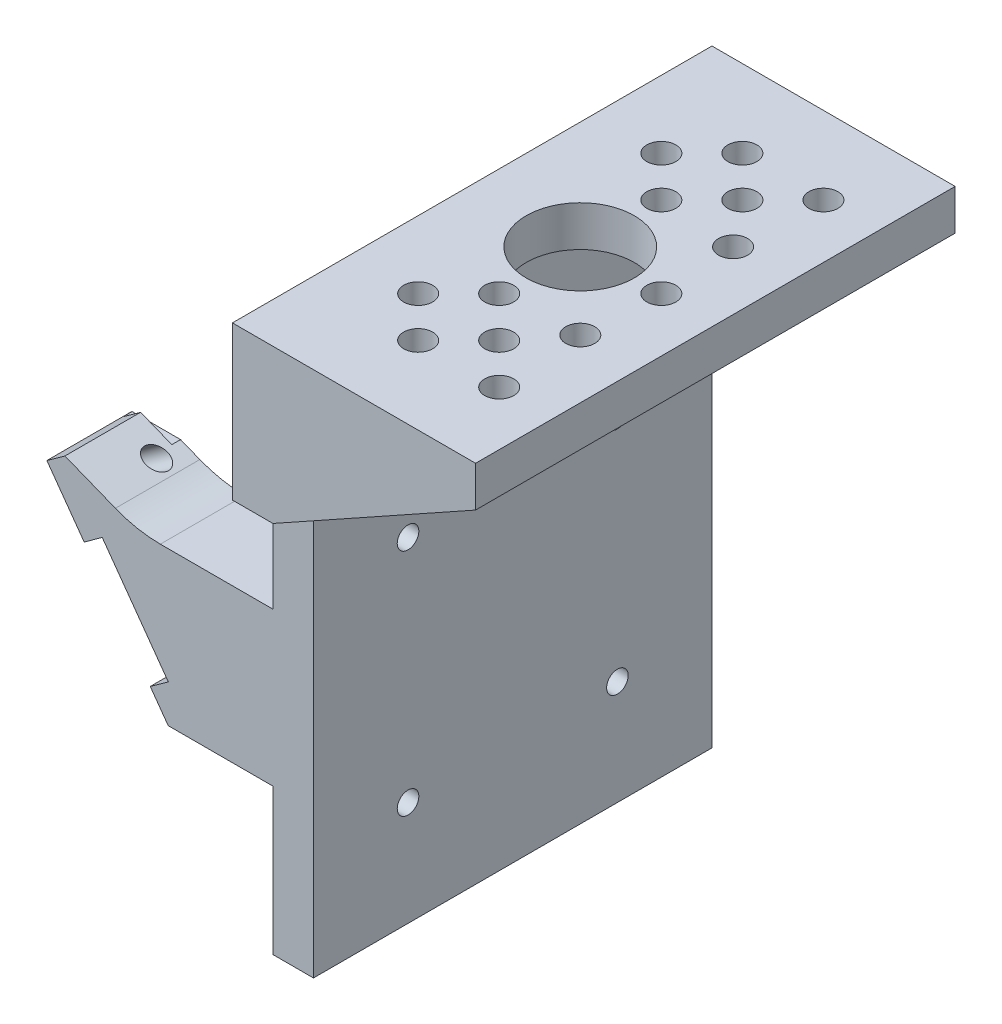
from build123d import *

# Parameters (mm, degrees)
EXTRUDE_1_DEPTH         = 35.5
SKETCH_2_W              = 29.5
SKETCH_2_H              = 39
CUT_EXTRUDE_2_DEPTH     = 15
SKETCH_3_W              = 3
SKETCH_3_H              = 30.64
CUT_EXTRUDE_3_DEPTH     = 3
SKETCH_4_R              = 0.8
CUT_EXTRUDE_4_DEPTH     = 3
SKETCH_5_R              = 1.075
SKETCH_5_R_2            = 4
CUT_EXTRUDE_6_DEPTH     = 4
SKETCH2_W               = 29.5
SKETCH2_H               = 42
BOSS_EXTRUDE1_DEPTH     = 22
CUT_EXTRUDE1_DEPTH      = 58.482606065
SKETCH4_W               = 17
SKETCH4_H               = 42
CUT_EXTRUDE2_DEPTH      = 22
SKETCH5_R               = 0.8
CUT_EXTRUDE3_DEPTH      = 6
CUT_EXTRUDE4_DEPTH      = 58.482606065
CUT_EXTRUDE4_DEPTH_BACK = 58.482606065
CUT_EXTRUDE5_DEPTH      = 57.282415378
CUT_EXTRUDE5_DEPTH_BACK = 57.282415378
CUT_EXTRUDE6_DEPTH      = 57.282415378
CUT_EXTRUDE6_DEPTH_BACK = 57.282415378
CUT_EXTRUDE7_DEPTH      = 57.073612332
CUT_EXTRUDE7_DEPTH_BACK = 57.073612332
SKETCH9_W               = 7.089051245
SKETCH9_H               = 1.624595939
CUT_EXTRUDE8_DEPTH      = 53.697841512
CUT_EXTRUDE8_DEPTH_BACK = 53.697841512
SKETCH11_W              = 2.8
SKETCH11_H              = 2.8
CUT_EXTRUDE9_DEPTH      = 58.864064842
CUT_EXTRUDE10_DEPTH     = 57.073612332
SKETCH13_W              = 6.25
SKETCH13_H              = 1.804834364
CUT_EXTRUDE11_DEPTH     = 1.647183607
FILLET1_R               = 10
FILLET2_R               = 9


with BuildPart() as part:
    # 草图1 → 凸台-拉伸1 (new body)
    with BuildSketch(Plane.XY):
        Polygon((0, 0), (18, 0), (18, -3), (3, -11.36), (3, -42), (0, -42), align=None)
    extrude(amount=EXTRUDE_1_DEPTH)

    # 草图2 → 切除-拉伸2 (cut)
    with BuildSketch(Plane(origin=(18, 0, 0), x_dir=(0, 0, -1), z_dir=(1, 0, 0))):
        with Locations((-17.75, -22.5)):
            Rectangle(SKETCH_2_W, SKETCH_2_H)
    extrude(amount=-CUT_EXTRUDE_2_DEPTH, mode=Mode.SUBTRACT)

    # 草图3 → 切除-拉伸3 (cut)
    with BuildSketch(Plane(origin=(0, 0, 0), x_dir=(0, 0, -1), z_dir=(1, 0, 0))):
        with Locations((-34, -26.68)):
            Rectangle(SKETCH_3_W, SKETCH_3_H)
        with Locations((-1.5, -26.68)):
            Rectangle(SKETCH_3_W, SKETCH_3_H)
    extrude(amount=CUT_EXTRUDE_3_DEPTH, mode=Mode.SUBTRACT)

    # 草图4 → 切除-拉伸4 (cut)
    with BuildSketch(Plane(origin=(0, 0, 0), x_dir=(0, 0, -1), z_dir=(1, 0, 0))):
        with Locations((-10, -17.25)):
            Circle(SKETCH_4_R)
        with Locations((-10, -34.25)):
            Circle(SKETCH_4_R)
        with Locations(Location((-25.5, -34.25, 0), (0, 0, 180))):
            Circle(SKETCH_4_R)
        with Locations(Location((-25.5, -17.25, 0), (0, 0, 180))):
            Circle(SKETCH_4_R)
    extrude(amount=CUT_EXTRUDE_4_DEPTH, mode=Mode.SUBTRACT)

    # 草图5 → 切除-拉伸6 (cut)
    with BuildSketch(Plane(origin=(0, 0, 0), x_dir=(1, 0, 0), z_dir=(0, 1, 0))):
        with Locations(Location((14, -17.75, 0), (0, 0, 270))):
            Circle(SKETCH_5_R)
        with Locations(Location((13.656854249, -23.406854249, 0), (0, 0, 270))):
            Circle(SKETCH_5_R)
        with Locations(Location((14, -29.75, 0), (0, 0, 270))):
            Circle(SKETCH_5_R)
        with Locations(Location((5, -26.75, 0), (0, 0, 270))):
            Circle(SKETCH_5_R)
        with Locations(Location((5, -8.75, 0), (0, 0, 270))):
            Circle(SKETCH_5_R)
        with Locations(Location((14, -5.75, 0), (0, 0, 270))):
            Circle(SKETCH_5_R)
        with Locations(Location((13.656854249, -12.093145751, 0), (0, 0, 270))):
            Circle(SKETCH_5_R)
        with Locations(Location((8, -17.75, 0), (0, 0, 270))):
            Circle(SKETCH_5_R_2)
        with Locations(Location((8, -23.75, 0), (0, 0, 270))):
            Circle(SKETCH_5_R)
        with Locations(Location((8, -11.75, 0), (0, 0, 270))):
            Circle(SKETCH_5_R)
        with Locations(Location((11, -26.75, 0), (0, 0, 270))):
            Circle(SKETCH_5_R)
        with Locations(Location((11, -8.75, 0), (0, 0, 270))):
            Circle(SKETCH_5_R)
        with Locations(Location((8, -29.75, 0), (0, 0, 270))):
            Circle(SKETCH_5_R)
        with Locations(Location((8, -5.75, 0), (0, 0, 270))):
            Circle(SKETCH_5_R)
    extrude(amount=-CUT_EXTRUDE_6_DEPTH, mode=Mode.SUBTRACT)

    # Sketch2 → Boss-Extrude1 (add)
    with BuildSketch(Plane.ZY):
        with Locations((17.75, -21)):
            Rectangle(SKETCH2_W, SKETCH2_H)
    extrude(amount=BOSS_EXTRUDE1_DEPTH)

    # Sketch3 → Cut-Extrude1 (cut, through all)
    with BuildSketch(Plane.XY.offset(32.5)):
        Polygon((0, -42), (-22, -11.36), (-22, -42), align=None)
    extrude(amount=-CUT_EXTRUDE1_DEPTH, mode=Mode.SUBTRACT)

    # Sketch4 → Cut-Extrude2 (cut)
    with BuildSketch(Plane.ZY.offset(22)):
        with Locations((17.75, -21)):
            Rectangle(SKETCH4_W, SKETCH4_H)
    extrude(amount=-CUT_EXTRUDE2_DEPTH, mode=Mode.SUBTRACT)

    # Sketch5 → Cut-Extrude3 (cut)
    with BuildSketch(Plane(origin=(-19.89820704, -14.287224376, 0), x_dir=(0, 0, 1), z_dir=(-0.8122979693681996, -0.5832426673009267, 0))):
        with Locations(Location((7.25, -7.719412775, 0), (0, 0, 270))):
            Circle(SKETCH5_R)
        with Locations(Location((7.25, -19.719412775, 0), (0, 0, 270))):
            Circle(SKETCH5_R)
        with Locations(Location((28.25, -7.719412775, 0), (0, 0, 270))):
            Circle(SKETCH5_R)
        with Locations(Location((28.25, -19.719412775, 0), (0, 0, 270))):
            Circle(SKETCH5_R)
    extrude(amount=-CUT_EXTRUDE3_DEPTH, mode=Mode.SUBTRACT)

    # Sketch6 → Cut-Extrude4 (cut, two sides: drawn at the far end of the back side and taken through both)
    with BuildSketch(Plane.XY.offset(32.5).offset(-CUT_EXTRUDE4_DEPTH_BACK)):
        Polygon((-18.640286498, -16.039164622), (0, -2.655146902), (0, 0), (-22, 0), (-22, -11.36), align=None)
    extrude(amount=CUT_EXTRUDE4_DEPTH + CUT_EXTRUDE4_DEPTH_BACK, mode=Mode.SUBTRACT)

    # Sketch7 → Cut-Extrude5 (cut, two sides: drawn at the far end of the back side and taken through both)
    with BuildSketch(Plane.XY.offset(32.5).offset(-CUT_EXTRUDE5_DEPTH_BACK)):
        Polygon((-5.922565911, -33.751480932), (0, -33.751480932), (0, -42), align=None)
    extrude(amount=CUT_EXTRUDE5_DEPTH + CUT_EXTRUDE5_DEPTH_BACK, mode=Mode.SUBTRACT)

    # Sketch8 → Cut-Extrude6 (cut, two sides: drawn at the far end of the back side and taken through both)
    with BuildSketch(Plane.XY.offset(32.5).offset(-CUT_EXTRUDE6_DEPTH_BACK)):
        Polygon((-16.735484956, -18.69203368), (-15.397481057, -17.731325919), (-17.302282599, -15.078456862), (-18.640286498, -16.039164622), align=None)
        Polygon((-13.97434516, -22.537548377), (-12.636341261, -21.576840617), (-8.798133161, -26.922417715), (-10.13613706, -27.883125476), align=None)
        Polygon((-7.089051245, -32.126884993), (-5.798120087, -31.199976198), (-3.966099716, -33.751480932), (-5.922565911, -33.751480932), align=None)
    extrude(amount=CUT_EXTRUDE6_DEPTH + CUT_EXTRUDE6_DEPTH_BACK, mode=Mode.SUBTRACT)

    # Sketch9 → Cut-Extrude7 (cut, two sides: drawn at the far end of the back side and taken through both)
    with BuildSketch(Plane.XY.offset(32.5).offset(-CUT_EXTRUDE7_DEPTH_BACK)):
        with Locations((-3.544525623, -32.939182962)):
            Rectangle(SKETCH9_W, SKETCH9_H)
    extrude(amount=CUT_EXTRUDE7_DEPTH + CUT_EXTRUDE7_DEPTH_BACK, mode=Mode.SUBTRACT)

    # Sketch10 → Cut-Extrude8 (cut, two sides: drawn at the far end of the back side and taken through both)
    with BuildSketch(Plane.XY.offset(9.25).offset(-CUT_EXTRUDE8_DEPTH_BACK)):
        Polygon((-10.059859583, -19.854018926), (0, -19.854018926), (0, -13.95755501), (0, -2.655146902), (-17.302282599, -15.078456862), (-15.397481057, -17.731325919), align=None)
    extrude(amount=CUT_EXTRUDE8_DEPTH + CUT_EXTRUDE8_DEPTH_BACK, mode=Mode.SUBTRACT)

    # Sketch11 → Cut-Extrude9 (cut, through all)
    with BuildSketch(Plane.ZY):
        with Locations((10, -17.25)):
            Rectangle(SKETCH11_W, SKETCH11_H)
        with Locations((25.5, -17.25)):
            Rectangle(SKETCH11_W, SKETCH11_H)
    extrude(amount=CUT_EXTRUDE9_DEPTH, mode=Mode.SUBTRACT)

    # Sketch12 → Cut-Extrude10 (cut, through all)
    with BuildSketch(Plane.XY.offset(32.5)):
        Polygon((-5.798120087, -31.199976198), (0, -31.199976198), (0, -32.126884993), (-9.163402462, -32.126884993), (-9.163402462, -31.199976198), align=None)
    extrude(amount=-CUT_EXTRUDE10_DEPTH, mode=Mode.SUBTRACT)

    # Sketch13 → Cut-Extrude11 (cut)
    with BuildSketch(Plane(origin=(-19.89820704, -14.287224376, 0), x_dir=(0, 0, 1), z_dir=(-0.8122979693681996, -0.5832426673009267, 0))):
        with Locations((6.125, -17.63999577)):
            Rectangle(SKETCH13_W, SKETCH13_H)
        with Locations((29.375, -17.63999577)):
            Rectangle(SKETCH13_W, SKETCH13_H)
    extrude(amount=-CUT_EXTRUDE11_DEPTH, mode=Mode.SUBTRACT)

    # Fillet1
    fillet1_edges = [part.edges().sort_by_distance(p)[0] for p in [
        (-10.059859583, -19.854018926, 6.125),
    ]]
    fillet(fillet1_edges, radius=FILLET1_R)

    # Fillet2
    fillet2_edges = [part.edges().sort_by_distance(p)[0] for p in [
        (-10.059859583, -19.854018926, 29.375),
    ]]
    fillet(fillet2_edges, radius=FILLET2_R)


solid = part.part
